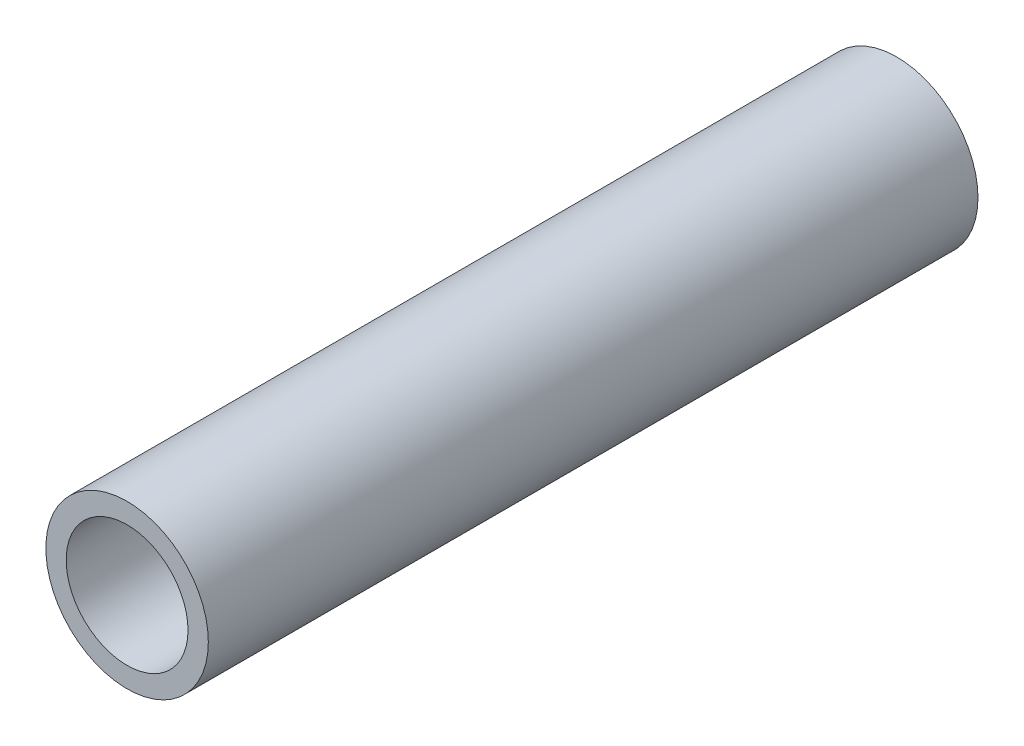
from build123d import *

# Parameters (mm, degrees)
SKETCH1_R           = 20
BOSS_EXTRUDE1_DEPTH = 189.48
SKETCH2_R           = 15
CUT_EXTRUDE1_DEPTH  = 192.579410167


with BuildPart() as part:
    # Sketch1 → Boss-Extrude1 (new body)
    with BuildSketch(Plane.XY):
        Circle(SKETCH1_R)
    extrude(amount=BOSS_EXTRUDE1_DEPTH)

    # Sketch2 → Cut-Extrude1 (cut, through all)
    with BuildSketch(Plane.XY.offset(189.48)):
        Circle(SKETCH2_R)
    extrude(amount=-CUT_EXTRUDE1_DEPTH, mode=Mode.SUBTRACT)


solid = part.part
